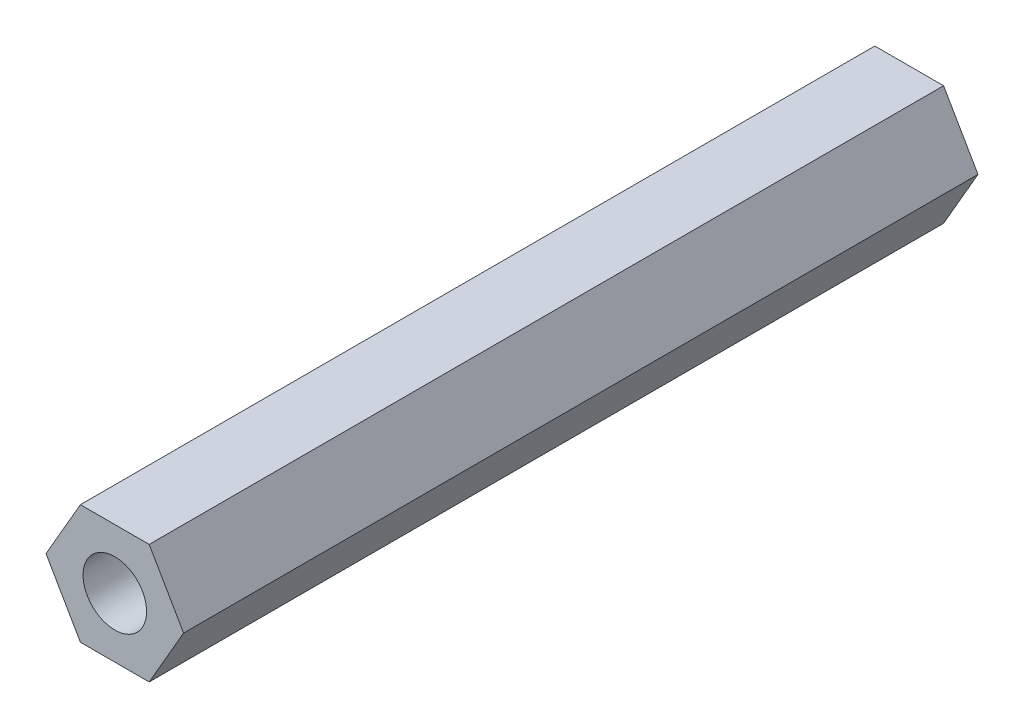
from build123d import *

# Parameters (mm, degrees)
SKETCH1_R           = 1.6
BOSS_EXTRUDE1_DEPTH = 40


with BuildPart() as part:
    # Sketch1 → Boss-Extrude1 (new body)
    with BuildSketch(Plane.XY):
        Polygon((1.732050808, -3), (3.464101615, 0), (1.732050808, 3), (-1.732050808, 3), (-3.464101615, 0), (-1.732050808, -3), align=None)
        Circle(SKETCH1_R, mode=Mode.SUBTRACT)
    extrude(amount=BOSS_EXTRUDE1_DEPTH)


solid = part.part
